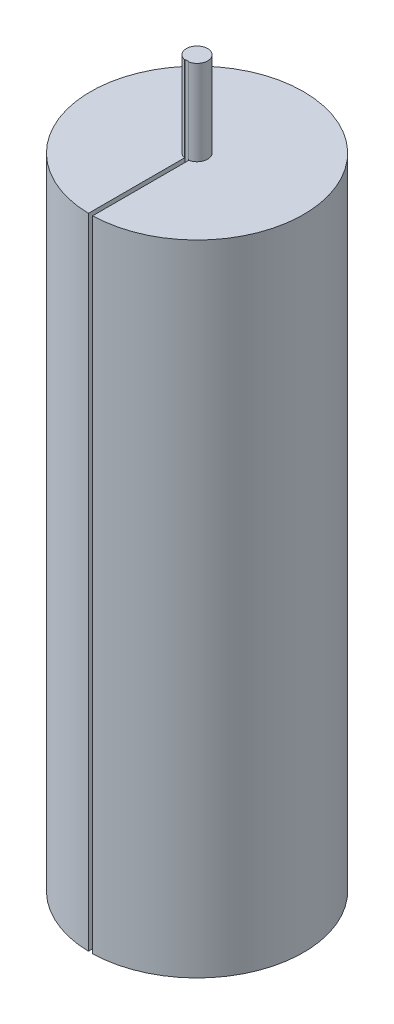
from build123d import *

# Parameters (mm, degrees)
SKETCH1_R           = 25
BOSS_EXTRUDE1_DEPTH = 150
SKETCH2_R           = 2.5
BOSS_EXTRUDE2_DEPTH = 20
SKETCH3_W           = 1
SKETCH3_H           = 26.625756483
CUT_EXTRUDE1_DEPTH  = 174.637553542


with BuildPart() as part:
    # Sketch1 → Boss-Extrude1 (new body)
    with BuildSketch(Plane(origin=(0, 0, 0), x_dir=(1, 0, 0), z_dir=(0, 1, 0))):
        with Locations(Location((0, 0, 0), (0, 0, 270))):
            Circle(SKETCH1_R)
    extrude(amount=BOSS_EXTRUDE1_DEPTH)

    # Sketch2 → Boss-Extrude2 (add)
    with BuildSketch(Plane(origin=(0, 150, 0), x_dir=(1, 0, 0), z_dir=(0, 1, 0))):
        with Locations(Location((0, 0, 0), (0, 0, 270))):
            Circle(SKETCH2_R)
    extrude(amount=BOSS_EXTRUDE2_DEPTH)

    # Sketch3 → Cut-Extrude1 (cut, through all)
    with BuildSketch(Plane.XZ):
        with Locations((0, 15.674840511)):
            Rectangle(SKETCH3_W, SKETCH3_H)
    extrude(amount=-CUT_EXTRUDE1_DEPTH, mode=Mode.SUBTRACT)


solid = part.part
